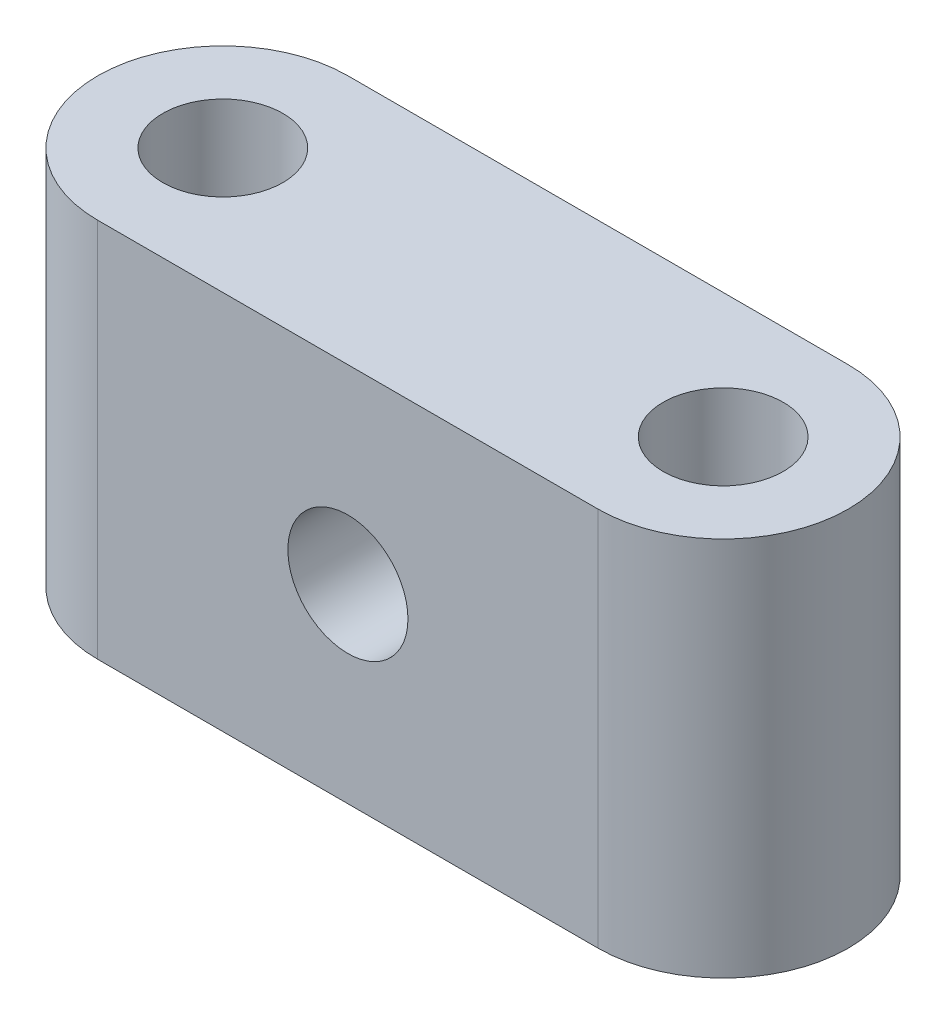
from build123d import *

# Parameters (mm, degrees)
SKETCH1_R           = 6
BOSS_EXTRUDE1_DEPTH = 19
SKETCH2_R           = 6
CUT_EXTRUDE1_DEPTH  = 12


with BuildPart() as part:
    # Sketch1 → Boss-Extrude1 (new, symmetric)
    with BuildSketch(Plane(origin=(0, 0, 0), x_dir=(1, 0, 0), z_dir=(0, 1, 0))):
        with BuildLine():
            Line((-25, 12.5), (25, 12.5))
            ThreePointArc((25, 12.5), (37.5, 0), (25, -12.5))
            Line((25, -12.5), (-25, -12.5))
            ThreePointArc((-25, -12.5), (-37.5, 0), (-25, 12.5))
        make_face()
        with Locations(Location((-25, 0, 0), (0, 0, 270))):
            Circle(SKETCH1_R, mode=Mode.SUBTRACT)
        with Locations(Location((25, 0, 0), (0, 0, 270))):
            Circle(SKETCH1_R, mode=Mode.SUBTRACT)
    extrude(amount=BOSS_EXTRUDE1_DEPTH, both=True)

    # Sketch2 → Cut-Extrude1 (cut)
    with BuildSketch(Plane.XY.offset(12.5)):
        Circle(SKETCH2_R)
    extrude(amount=-CUT_EXTRUDE1_DEPTH, mode=Mode.SUBTRACT)


solid = part.part
